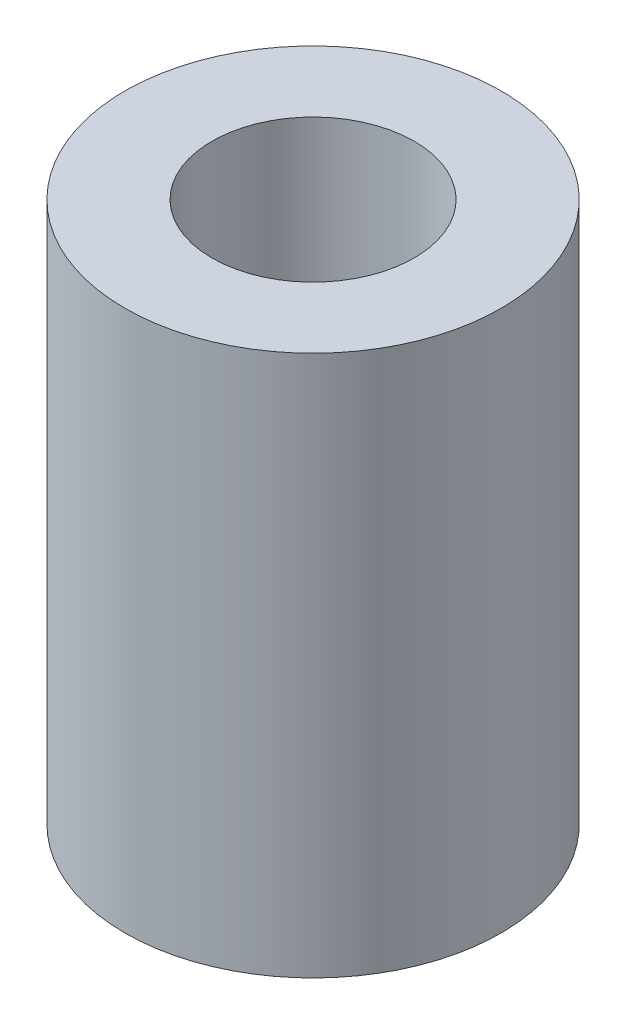
from build123d import *

# Parameters (mm, degrees)
SKETCH_1_R        = 4
SKETCH_1_R_2      = 2.15
EXTRUDE_311_DEPTH = 11.5


with BuildPart() as part:
    # Эскиз1 → Extrude 311 (new body)
    with BuildSketch(Plane(origin=(0, 0, 0), x_dir=(1, 0, 0), z_dir=(0, 1, 0))):
        with Locations(Location((0, 0, 0), (0, 0, 270))):
            Circle(SKETCH_1_R)
        with Locations(Location((0, 0, 0), (0, 0, 270))):
            Circle(SKETCH_1_R_2, mode=Mode.SUBTRACT)
    extrude(amount=EXTRUDE_311_DEPTH)


solid = part.part
